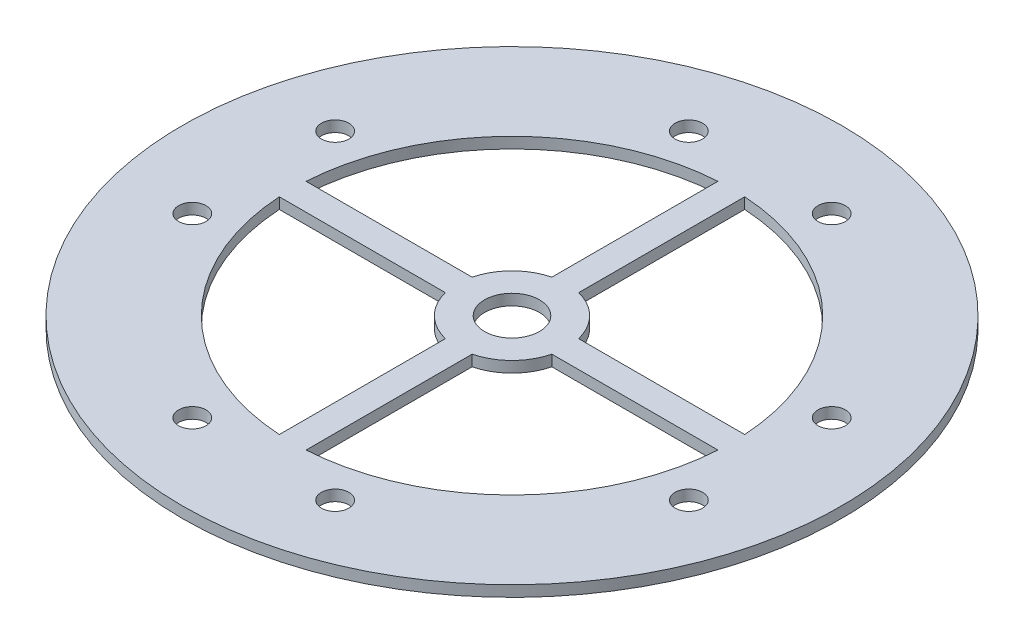
from build123d import *

# Parameters (mm, degrees)
SKETCH1_R           = 76.2
SKETCH1_R_2         = 3.175
SKETCH1_R_3         = 6.35
BOSS_EXTRUDE1_DEPTH = 2.54


with BuildPart() as part:
    # Sketch1 → Boss-Extrude1 (new body)
    with BuildSketch(Plane(origin=(0, 0, 0), x_dir=(1, 0, 0), z_dir=(0, 1, 0))):
        with Locations(Location((0, 0, 0), (0, 0, 270))):
            Circle(SKETCH1_R)
        with Locations(Location((-16.51, 57.404, 0), (0, 0, 270))):
            Circle(SKETCH1_R_2, mode=Mode.SUBTRACT)
        with Locations(Location((16.51, 57.404, 0), (0, 0, 270))):
            Circle(SKETCH1_R_2, mode=Mode.SUBTRACT)
        with Locations(Location((57.404, -16.51, 0), (0, 0, 270))):
            Circle(SKETCH1_R_2, mode=Mode.SUBTRACT)
        with Locations(Location((57.404, 16.51, 0), (0, 0, 270))):
            Circle(SKETCH1_R_2, mode=Mode.SUBTRACT)
        with Locations(Location((-16.51, -57.404, 0), (0, 0, 270))):
            Circle(SKETCH1_R_2, mode=Mode.SUBTRACT)
        with Locations(Location((16.51, -57.404, 0), (0, 0, 270))):
            Circle(SKETCH1_R_2, mode=Mode.SUBTRACT)
        with Locations(Location((-57.404, 16.51, 0), (0, 0, 270))):
            Circle(SKETCH1_R_2, mode=Mode.SUBTRACT)
        with Locations(Location((-57.404, -16.51, 0), (0, 0, 270))):
            Circle(SKETCH1_R_2, mode=Mode.SUBTRACT)
        with Locations(Location((0, 0, 0), (0, 0, 270))):
            Circle(SKETCH1_R_3, mode=Mode.SUBTRACT)
        with BuildLine():
            Line((-3.099389971, 12.315996988), (-3.099389971, 50.705362456))
            ThreePointArc((-3.099389971, 50.705362456), (-35.921024484, 35.921024484), (-50.705362456, 3.099389971))
            Line((-50.705362456, 3.099389971), (-12.315996988, 3.099389971))
            ThreePointArc((-12.315996988, 3.099389971), (-8.980256121, 8.980256121), (-3.099389971, 12.315996988))
        make_face(mode=Mode.SUBTRACT)
        with BuildLine():
            Line((3.099389971, 12.315996988), (3.099389971, 50.705362456))
            ThreePointArc((3.099389971, 50.705362456), (35.921024484, 35.921024484), (50.705362456, 3.099389971))
            Line((50.705362456, 3.099389971), (12.315996988, 3.099389971))
            ThreePointArc((12.315996988, 3.099389971), (8.980256121, 8.980256121), (3.099389971, 12.315996988))
        make_face(mode=Mode.SUBTRACT)
        with BuildLine():
            Line((12.315996988, -3.099389971), (50.705362456, -3.099389971))
            ThreePointArc((50.705362456, -3.099389971), (35.921024484, -35.921024484), (3.099389971, -50.705362456))
            Line((3.099389971, -50.705362456), (3.099389971, -12.315996988))
            ThreePointArc((3.099389971, -12.315996988), (8.980256121, -8.980256121), (12.315996988, -3.099389971))
        make_face(mode=Mode.SUBTRACT)
        with BuildLine():
            Line((-3.099389971, -12.315996988), (-3.099389971, -50.705362456))
            ThreePointArc((-3.099389971, -50.705362456), (-35.921024484, -35.921024484), (-50.705362456, -3.099389971))
            Line((-50.705362456, -3.099389971), (-12.315996988, -3.099389971))
            ThreePointArc((-12.315996988, -3.099389971), (-8.980256121, -8.980256121), (-3.099389971, -12.315996988))
        make_face(mode=Mode.SUBTRACT)
    extrude(amount=BOSS_EXTRUDE1_DEPTH)


solid = part.part
